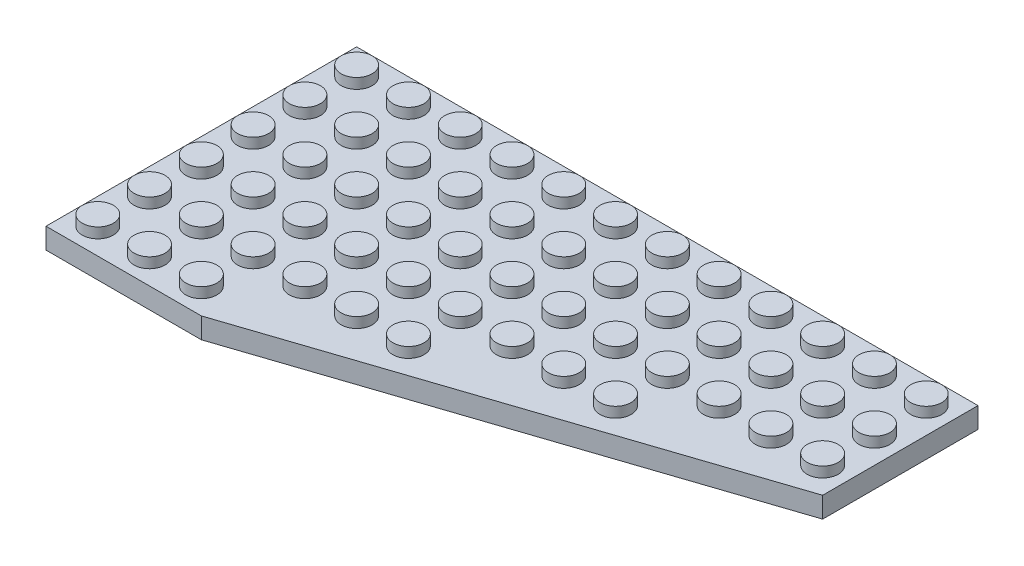
from build123d import *

# Parameters (mm, degrees)
BOSS_EXTRUDE1_DEPTH  = 3.2
SKETCH2_R            = 2.4
BOSS_EXTRUDE2_DEPTH  = 1.6
LPATTERN1_COUNT      = 12
LPATTERN1_PITCH      = 8
LPATTERN1_COUNT_DIR2 = 3
LPATTERN1_PITCH_DIR2 = 8
SKETCH3_R            = 2.4
BOSS_EXTRUDE3_DEPTH  = 1.6
LPATTERN2_COUNT      = 9
LPATTERN2_PITCH      = 8
SKETCH4_R            = 2.4
BOSS_EXTRUDE4_DEPTH  = 1.6
LPATTERN3_COUNT      = 6
LPATTERN3_PITCH      = 8
SKETCH5_R            = 2.4
BOSS_EXTRUDE5_DEPTH  = 1.6
LPATTERN4_COUNT      = 3
LPATTERN4_PITCH      = 8
SHELL1_T             = -1.6


with BuildPart() as part:
    # Sketch1 → Boss-Extrude1 (new body)
    with BuildSketch(Plane(origin=(0, 0, 0), x_dir=(1, 0, 0), z_dir=(0, 1, 0))):
        Polygon((0, 0), (96, 0), (96, -24), (24, -48), (0, -48), align=None)
    extrude(amount=BOSS_EXTRUDE1_DEPTH)

    # Sketch2 → Boss-Extrude2 (add)
    with BuildSketch(Plane(origin=(0, 3.2, 0), x_dir=(1, 0, 0), z_dir=(0, 1, 0))):
        with Locations(Location((4, -4, 0), (0, 0, 90))):
            Circle(SKETCH2_R)
    boss_extrude2 = extrude(amount=BOSS_EXTRUDE2_DEPTH)

    # LPattern1: Boss-Extrude2 12 × 3
    with Locations(*[(i * LPATTERN1_PITCH, 0, j * LPATTERN1_PITCH_DIR2) for i in range(LPATTERN1_COUNT) for j in range(LPATTERN1_COUNT_DIR2) if (i, j) != (0, 0)]):
        add(boss_extrude2)

    # Sketch3 → Boss-Extrude3 (add)
    with BuildSketch(Plane(origin=(0, 3.2, 0), x_dir=(1, 0, 0), z_dir=(0, 1, 0))):
        with Locations(Location((4, -28, 0), (0, 0, 90))):
            Circle(SKETCH3_R)
    boss_extrude3 = extrude(amount=BOSS_EXTRUDE3_DEPTH)

    # LPattern2: Boss-Extrude3 ×9
    with Locations(*[(i * LPATTERN2_PITCH, 0, 0) for i in range(1, LPATTERN2_COUNT)]):
        add(boss_extrude3)

    # Sketch4 → Boss-Extrude4 (add)
    with BuildSketch(Plane(origin=(0, 3.2, 0), x_dir=(1, 0, 0), z_dir=(0, 1, 0))):
        with Locations(Location((4, -36, 0), (0, 0, 90))):
            Circle(SKETCH4_R)
    boss_extrude4 = extrude(amount=BOSS_EXTRUDE4_DEPTH)

    # LPattern3: Boss-Extrude4 ×6
    with Locations(*[(i * LPATTERN3_PITCH, 0, 0) for i in range(1, LPATTERN3_COUNT)]):
        add(boss_extrude4)

    # Sketch5 → Boss-Extrude5 (add)
    with BuildSketch(Plane(origin=(0, 3.2, 0), x_dir=(1, 0, 0), z_dir=(0, 1, 0))):
        with Locations(Location((4, -44, 0), (0, 0, 90))):
            Circle(SKETCH5_R)
    boss_extrude5 = extrude(amount=BOSS_EXTRUDE5_DEPTH)

    # LPattern4: Boss-Extrude5 ×3
    with Locations(*[(i * LPATTERN4_PITCH, 0, 0) for i in range(1, LPATTERN4_COUNT)]):
        add(boss_extrude5)

    # Shell1
    shell1_openings = [part.faces().sort_by_distance(p)[0] for p in [
        (42.461538462, 0, 20.307692308),
    ]]
    offset(amount=SHELL1_T, openings=shell1_openings, kind=Kind.INTERSECTION)


solid = part.part
